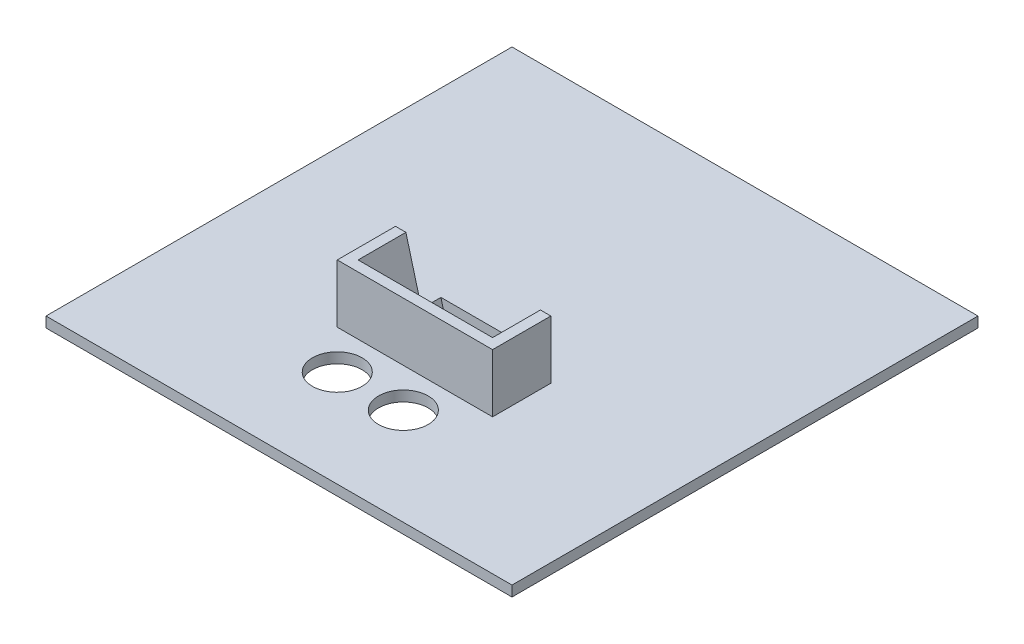
from build123d import *

# Parameters (mm, degrees)
SKETCH1_W           = 152.4
SKETCH1_H           = 152.4
BOSS_EXTRUDE1_DEPTH = 3.4036
SKETCH2_R           = 8.10895
CUT_EXTRUDE1_DEPTH  = 216.553020143
SKETCH3_W           = 50.8
SKETCH3_H           = 19.05
BOSS_EXTRUDE2_DEPTH = 19.05
SKETCH4_W           = 43.9928
SKETCH4_H           = 21.9964
CUT_EXTRUDE2_DEPTH  = 217.692602903
DRAFT1_ANGLE        = 15


with BuildPart() as part:
    # Sketch1 → Boss-Extrude1 (new body)
    with BuildSketch(Plane(origin=(0, 0, 0), x_dir=(1, 0, 0), z_dir=(0, 1, 0))):
        with Locations((76.2, 76.2)):
            Rectangle(SKETCH1_W, SKETCH1_H)
    extrude(amount=BOSS_EXTRUDE1_DEPTH)

    # Sketch2 → Cut-Extrude1 (cut, through all)
    with BuildSketch(Plane(origin=(0, 3.4036, 0), x_dir=(1, 0, 0), z_dir=(0, 1, 0))):
        with Locations(Location((63.5, 31.75, 0), (0, 0, 270))):
            Circle(SKETCH2_R)
        with Locations(Location((85.1154, 31.75, 0), (0, 0, 270))):
            Circle(SKETCH2_R)
    extrude(amount=-CUT_EXTRUDE1_DEPTH, mode=Mode.SUBTRACT)

    # Sketch3 → Boss-Extrude2 (add)
    with BuildSketch(Plane(origin=(0, 3.4036, 0), x_dir=(1, 0, 0), z_dir=(0, 1, 0))):
        with Locations((76.2, 53.975)):
            Rectangle(SKETCH3_W, SKETCH3_H)
    extrude(amount=BOSS_EXTRUDE2_DEPTH)

    # Sketch4 → Cut-Extrude2 (cut, through all)
    with BuildSketch(Plane(origin=(0, 22.4536, 0), x_dir=(1, 0, 0), z_dir=(0, 1, 0))):
        with Locations((76.2, 58.8518)):
            Rectangle(SKETCH4_W, SKETCH4_H)
    extrude(amount=-CUT_EXTRUDE2_DEPTH, mode=Mode.SUBTRACT)

    # Draft1
    draft1_faces = [part.faces().sort_by_distance(p)[0] for p in [
        (54.2036, 10.674787523, -56.314190406),
        (98.1964, 10.674787523, -56.314190406),
        (76.2, 11.2268, -47.8536),
    ]]
    draft(draft1_faces, Plane.ZX.offset(22.4536), DRAFT1_ANGLE)


solid = part.part
